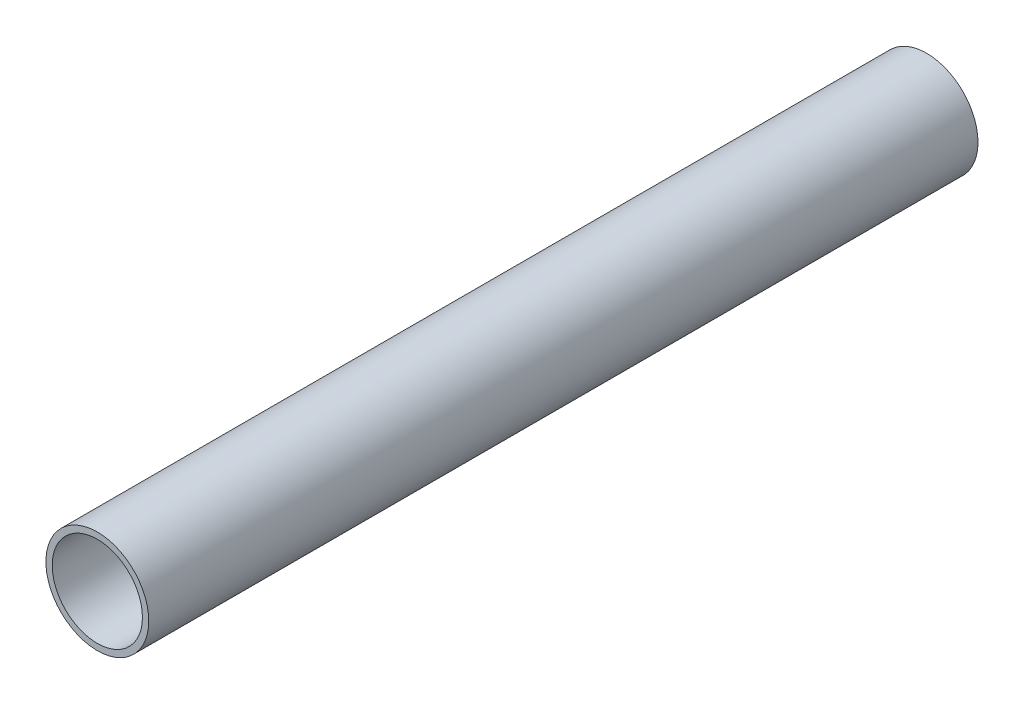
from build123d import *

# Parameters (mm, degrees)
SKETCH1_R           = 3.1
SKETCH1_R_2         = 2.72
BOSS_EXTRUDE1_DEPTH = 25


with BuildPart() as part:
    # Sketch1 → Boss-Extrude1 (new, symmetric)
    with BuildSketch(Plane.XY):
        Circle(SKETCH1_R)
        Circle(SKETCH1_R_2, mode=Mode.SUBTRACT)
    extrude(amount=BOSS_EXTRUDE1_DEPTH, both=True)


solid = part.part
